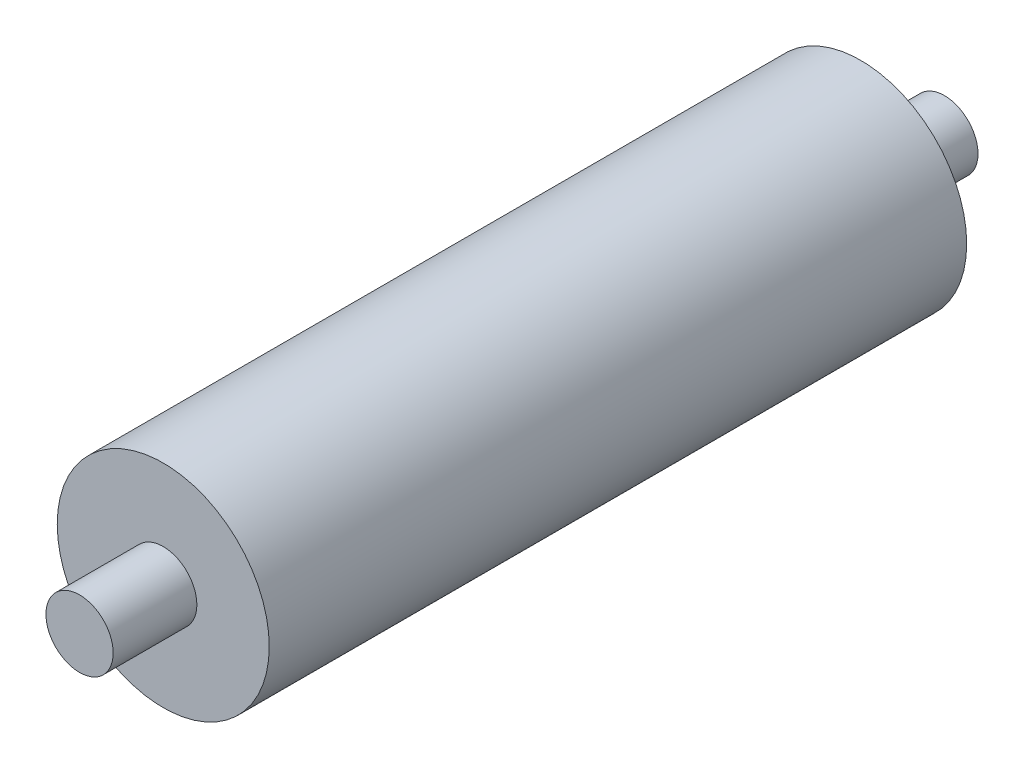
from build123d import *

# Parameters (mm, degrees)
SKETCH1_R                 = 19
SKETCH1_R_2               = 14
BOSS_EXTRUDE1_DEPTH       = 125
BOSS_EXTRUDE2_START       = 7.5
SKETCH2_R                 = 14
BOSS_EXTRUDE2_DEPTH       = 7.5
CUT_EXTRUDE1_DEPTH        = 121.53319045
CUT_EXTRUDE1_DEPTH_BACK   = 121.53319045
SKETCH4_R                 = 6.025
SKETCH5_R                 = 14
BOSS_EXTRUDE3_DEPTH       = 7.5
BOSS_EXTRUDE4_DEPTH       = 15
BOSS_EXTRUDE4_DEPTH_BACK  = 140
SKETCH7_R                 = 6.025
CUT_EXTRUDE2_DEPTH        = 143.555252446
CUT_EXTRUDE2_DEPTH_BACK   = 143.555252446
SKETCH8_R                 = 1.5
SKETCH9_R                 = 3.5
CUT_EXTRUDE3_DEPTH        = 22
SKETCH11_R                = 15
BOSS_EXTRUDE5_DEPTH       = 5
LPATTERN1_COUNT           = 2
LPATTERN1_PITCH           = 30
LPATTERN2_COPY_1_SKETCH_R = 15
LPATTERN2_COPY_1_DEPTH    = 5
LPATTERN2_COPY_2_SKETCH_R = 15
LPATTERN2_COPY_2_DEPTH    = 5


with BuildPart() as part:
    # Sketch1 → Boss-Extrude1 (new body)
    with BuildSketch(Plane.XY):
        Circle(SKETCH1_R)
        Circle(SKETCH1_R_2, mode=Mode.SUBTRACT)
    extrude(amount=-BOSS_EXTRUDE1_DEPTH)

    # Sketch2 → Boss-Extrude2 (add)
    with BuildSketch(Plane.XY.offset(-7.5).offset(BOSS_EXTRUDE2_START)):
        Circle(SKETCH2_R)
    extrude(amount=-BOSS_EXTRUDE2_DEPTH)

    # Sketch4 → Cut-Extrude1 (cut, two sides: drawn at the far end of the back side and taken through both)
    with BuildSketch(Plane.XY.offset(-7.5).offset(-CUT_EXTRUDE1_DEPTH_BACK)):
        Circle(SKETCH4_R)
    extrude(amount=CUT_EXTRUDE1_DEPTH + CUT_EXTRUDE1_DEPTH_BACK, mode=Mode.SUBTRACT)

    # Sketch5 → Boss-Extrude3 (add)
    with BuildSketch(Plane(origin=(0, 0, -117.5), x_dir=(-1, 0, 0), z_dir=(0, 0, -1))):
        with Locations(Location((0, 0, 0), (0, 0, 180))):
            Circle(SKETCH5_R)
    extrude(amount=BOSS_EXTRUDE3_DEPTH)

    # Sketch7 → Boss-Extrude4 (add, two sides: drawn at the far end of the back side and taken through both)
    with BuildSketch(Plane.XY.offset(-BOSS_EXTRUDE4_DEPTH_BACK)):
        Circle(SKETCH7_R)
    extrude(amount=BOSS_EXTRUDE4_DEPTH + BOSS_EXTRUDE4_DEPTH_BACK)

    # Sketch8 → Cut-Extrude2 (cut, two sides: drawn at the far end of the back side and taken through both)
    with BuildSketch(Plane(origin=(0, 0, 0), x_dir=(1, 0, 0), z_dir=(0, 1, 0)).offset(-CUT_EXTRUDE2_DEPTH_BACK)):
        with Locations(Location((0, 127.5, 0), (0, 0, 270))):
            Circle(SKETCH8_R)
    extrude(amount=CUT_EXTRUDE2_DEPTH + CUT_EXTRUDE2_DEPTH_BACK, mode=Mode.SUBTRACT)

    # Sketch9 → Cut-Extrude3 (cut)
    with BuildSketch(Plane(origin=(0, 0, -140), x_dir=(-1, 0, 0), z_dir=(0, 0, -1))):
        Circle(SKETCH9_R)
    extrude(amount=-CUT_EXTRUDE3_DEPTH, mode=Mode.SUBTRACT)

    # Sketch11 → Boss-Extrude5 (add, symmetric)
    with BuildSketch(Plane(origin=(0, 0, -62.5), x_dir=(-1, 0, 0), z_dir=(0, 0, -1))):
        Circle(SKETCH11_R)
    boss_extrude5 = extrude(amount=BOSS_EXTRUDE5_DEPTH, both=True)

    # LPattern1: Boss-Extrude5 ×2
    with Locations(*[(0, 0, -i * LPATTERN1_PITCH) for i in range(1, LPATTERN1_COUNT)]):
        add(boss_extrude5)

    # LPattern2 copy 1 sketch → LPattern2 copy 1 (add, symmetric)
    with BuildSketch(Plane(origin=(0, 0, -62.5), x_dir=(-1, 0, 0), z_dir=(0, 0, -1))):
        Circle(LPATTERN2_COPY_1_SKETCH_R)
    extrude(amount=LPATTERN2_COPY_1_DEPTH, both=True)

    # LPattern2 copy 2 sketch → LPattern2 copy 2 (add, symmetric)
    with BuildSketch(Plane(origin=(0, 0, -32.5), x_dir=(-1, 0, 0), z_dir=(0, 0, -1))):
        Circle(LPATTERN2_COPY_2_SKETCH_R)
    extrude(amount=LPATTERN2_COPY_2_DEPTH, both=True)


solid = part.part
